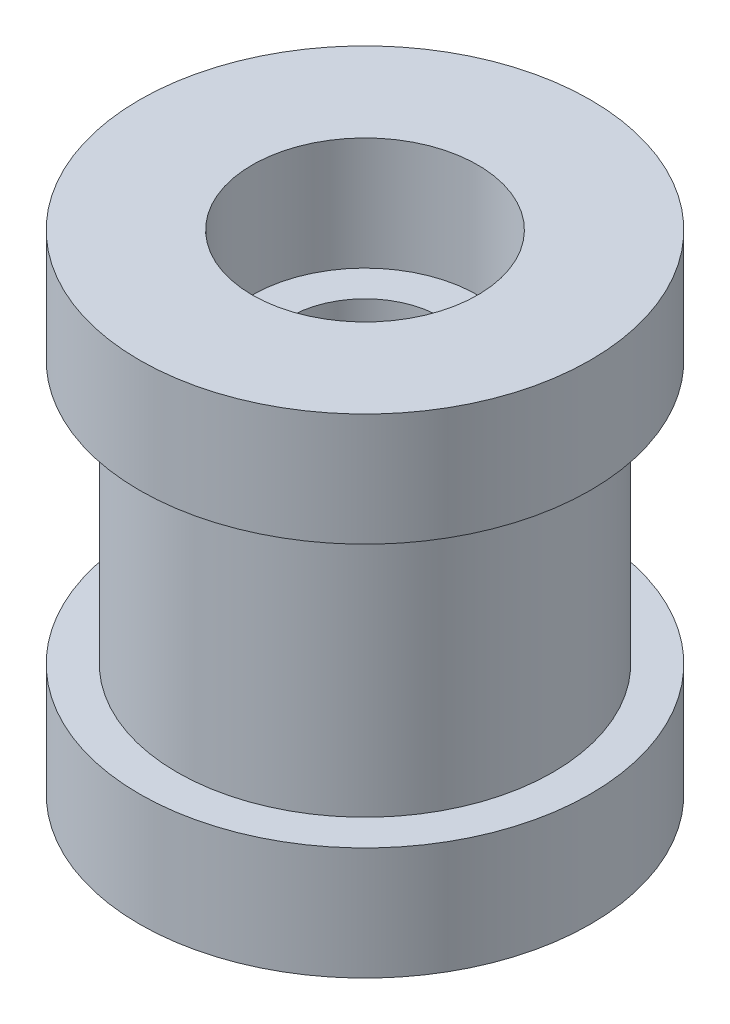
from build123d import *


with BuildPart() as part:
    # Sketch1 → Revolve4 (revolve)
    with BuildSketch(Plane.XY, mode=Mode.PRIVATE) as revolve4_sk:
        Polygon((-60, 130), (-30, 130), (-30, 100), (-20, 100), (-20, 85), (-35, 85), (-35, 45), (-20, 45), (-20, 30), (-30, 30), (-30, 0), (-60, 0), (-60, 30), (-50, 30), (-50, 100), (-60, 100), align=None)
    revolve(revolve4_sk.sketch.rotate(Axis((0, 78.486767827, 0), (0, -1, 0)), 270), axis=Axis((0, 78.486767827, 0), (0, -1, 0)))


solid = part.part
